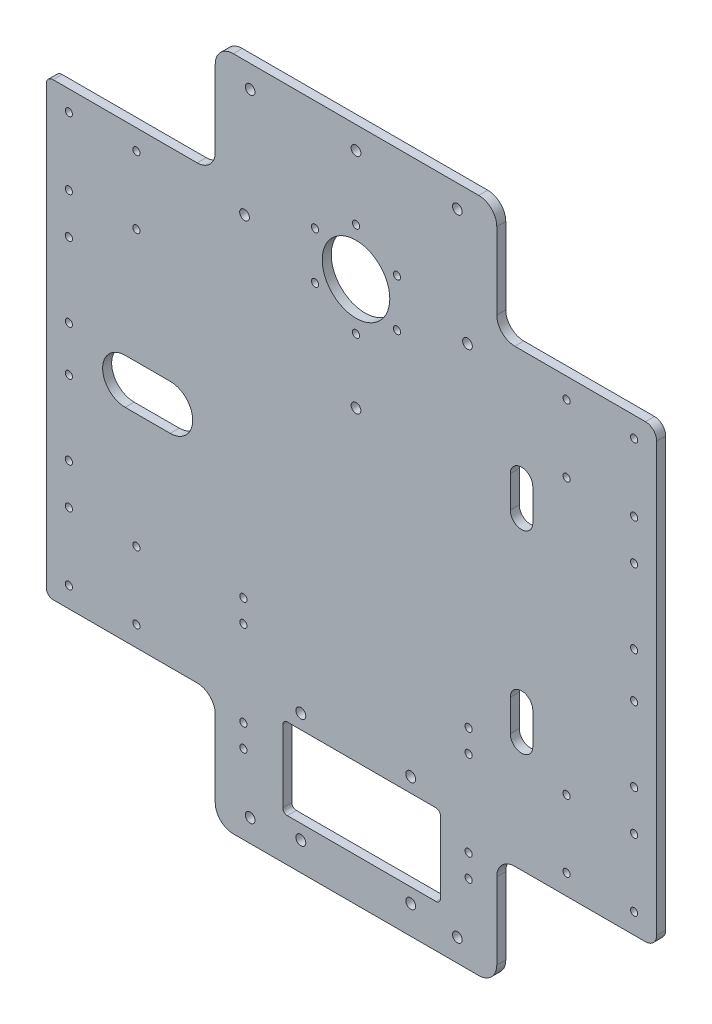
from build123d import *

# Parameters (mm, degrees)
SKETCH_281X300_25_R   = 1.6
SKETCH_281X300_25_R_2 = 15
SKETCH_281X300_25_R_3 = 2.15
SKETCH_281X300_25_R_4 = 2.2
F_4MM_DEPTH           = 4


with BuildPart() as part:
    # 底板轮廓_281x300_安装孔外移25 → 凸台拉伸_4mm (new body)
    with BuildSketch(Plane.XY):
        with BuildLine():
            Line((-55.5, 108), (-55.5, 142))
            ThreePointArc((-55.5, 142), (-53.156854249, 147.656854249), (-47.5, 150))
            Line((-47.5, 150), (61.5, 150))
            ThreePointArc((61.5, 150), (67.156854249, 147.656854249), (69.5, 142))
            Line((69.5, 142), (69.5, 108))
            ThreePointArc((69.5, 108), (71.843145751, 102.343145751), (77.5, 100))
            Line((77.5, 100), (135.5, 100))
            ThreePointArc((135.5, 100), (139.035533906, 98.535533906), (140.5, 95))
            Line((140.5, 95), (140.5, -95))
            ThreePointArc((140.5, -95), (139.035533906, -98.535533906), (135.5, -100))
            Line((135.5, -100), (77.5, -100))
            ThreePointArc((77.5, -100), (71.843145751, -102.343145751), (69.5, -108))
            Line((69.5, -108), (69.5, -142))
            ThreePointArc((69.5, -142), (67.156854249, -147.656854249), (61.5, -150))
            Line((61.5, -150), (-47.5, -150))
            ThreePointArc((-47.5, -150), (-53.156854249, -147.656854249), (-55.5, -142))
            Line((-55.5, -142), (-55.5, -108))
            ThreePointArc((-55.5, -108), (-57.843145751, -102.343145751), (-63.5, -100))
            Line((-63.5, -100), (-127.5, -100))
            ThreePointArc((-127.5, -100), (-129.621320344, -99.121320344), (-130.5, -97))
            Line((-130.5, -97), (-130.5, -13))
            Line((-130.5, -13), (-130.5, 97))
            ThreePointArc((-130.5, 97), (-129.621320344, 99.121320344), (-127.5, 100))
            Line((-127.5, 100), (-63.5, 100))
            ThreePointArc((-63.5, 100), (-57.843145751, 102.343145751), (-55.5, 108))
        make_face()
        with Locations((100.5, -61)):
            Circle(SKETCH_281X300_25_R, mode=Mode.SUBTRACT)
        with Locations((130.5, -61)):
            Circle(SKETCH_281X300_25_R, mode=Mode.SUBTRACT)
        with Locations((100.5, 61)):
            Circle(SKETCH_281X300_25_R, mode=Mode.SUBTRACT)
        with Locations((7, 90.5)):
            Circle(SKETCH_281X300_25_R_2, mode=Mode.SUBTRACT)
        with Locations((7, 140)):
            Circle(SKETCH_281X300_25_R_3, mode=Mode.SUBTRACT)
        with Locations((-42.5, 90.5)):
            Circle(SKETCH_281X300_25_R_3, mode=Mode.SUBTRACT)
        with Locations((56.5, 90.5)):
            Circle(SKETCH_281X300_25_R_3, mode=Mode.SUBTRACT)
        with Locations((-40, 140)):
            Circle(SKETCH_281X300_25_R_3, mode=Mode.SUBTRACT)
        with Locations((130.5, 61)):
            Circle(SKETCH_281X300_25_R, mode=Mode.SUBTRACT)
        with Locations((7, 41)):
            Circle(SKETCH_281X300_25_R_3, mode=Mode.SUBTRACT)
        with Locations((31.290367902, -137.395183951)):
            Circle(SKETCH_281X300_25_R_4, mode=Mode.SUBTRACT)
        with Locations((-17.5, -137.395183951)):
            Circle(SKETCH_281X300_25_R_4, mode=Mode.SUBTRACT)
        with Locations((-17.5, -88.604816049)):
            Circle(SKETCH_281X300_25_R_4, mode=Mode.SUBTRACT)
        with Locations((31.290367902, -88.604816049)):
            Circle(SKETCH_281X300_25_R_4, mode=Mode.SUBTRACT)
        with Locations((7, 111.5)):
            Circle(SKETCH_281X300_25_R, mode=Mode.SUBTRACT)
        with Locations((25.186533479, 101)):
            Circle(SKETCH_281X300_25_R, mode=Mode.SUBTRACT)
        with Locations((100.5, -91)):
            Circle(SKETCH_281X300_25_R, mode=Mode.SUBTRACT)
        with Locations((25.186533479, 80)):
            Circle(SKETCH_281X300_25_R, mode=Mode.SUBTRACT)
        with Locations((100.5, 91)):
            Circle(SKETCH_281X300_25_R, mode=Mode.SUBTRACT)
        with Locations((7, 69.5)):
            Circle(SKETCH_281X300_25_R, mode=Mode.SUBTRACT)
        with Locations((130.5, 91)):
            Circle(SKETCH_281X300_25_R, mode=Mode.SUBTRACT)
        with Locations((130.5, -91)):
            Circle(SKETCH_281X300_25_R, mode=Mode.SUBTRACT)
        with Locations((-43, -105)):
            Circle(SKETCH_281X300_25_R, mode=Mode.SUBTRACT)
        with Locations((57, -57)):
            Circle(SKETCH_281X300_25_R, mode=Mode.SUBTRACT)
        with Locations((-43, -57)):
            Circle(SKETCH_281X300_25_R, mode=Mode.SUBTRACT)
        with Locations((57, -105)):
            Circle(SKETCH_281X300_25_R, mode=Mode.SUBTRACT)
        with Locations((-11.186533479, 80)):
            Circle(SKETCH_281X300_25_R, mode=Mode.SUBTRACT)
        with Locations((-11.186533479, 101)):
            Circle(SKETCH_281X300_25_R, mode=Mode.SUBTRACT)
        with Locations((130.5, 10)):
            Circle(SKETCH_281X300_25_R, mode=Mode.SUBTRACT)
        with Locations((130.5, -10)):
            Circle(SKETCH_281X300_25_R, mode=Mode.SUBTRACT)
        with Locations((-120.5, 10)):
            Circle(SKETCH_281X300_25_R, mode=Mode.SUBTRACT)
        with Locations((-120.5, -10)):
            Circle(SKETCH_281X300_25_R, mode=Mode.SUBTRACT)
        with Locations((-43, -115)):
            Circle(SKETCH_281X300_25_R, mode=Mode.SUBTRACT)
        with Locations((57, -67)):
            Circle(SKETCH_281X300_25_R, mode=Mode.SUBTRACT)
        with Locations((57, -115)):
            Circle(SKETCH_281X300_25_R, mode=Mode.SUBTRACT)
        with Locations((-43, -67)):
            Circle(SKETCH_281X300_25_R, mode=Mode.SUBTRACT)
        with Locations((-120.5, -91)):
            Circle(SKETCH_281X300_25_R, mode=Mode.SUBTRACT)
        with Locations((-90.5, -91)):
            Circle(SKETCH_281X300_25_R, mode=Mode.SUBTRACT)
        with Locations((-120.5, 91)):
            Circle(SKETCH_281X300_25_R, mode=Mode.SUBTRACT)
        with Locations((-90.5, 91)):
            Circle(SKETCH_281X300_25_R, mode=Mode.SUBTRACT)
        with Locations((-90.5, 61)):
            Circle(SKETCH_281X300_25_R, mode=Mode.SUBTRACT)
        with Locations((-120.5, 61)):
            Circle(SKETCH_281X300_25_R, mode=Mode.SUBTRACT)
        with Locations((-90.5, -61)):
            Circle(SKETCH_281X300_25_R, mode=Mode.SUBTRACT)
        with Locations((-120.5, -61)):
            Circle(SKETCH_281X300_25_R, mode=Mode.SUBTRACT)
        with Locations((130.5, 43)):
            Circle(SKETCH_281X300_25_R, mode=Mode.SUBTRACT)
        with Locations((130.5, -43)):
            Circle(SKETCH_281X300_25_R, mode=Mode.SUBTRACT)
        with Locations((-120.5, 43)):
            Circle(SKETCH_281X300_25_R, mode=Mode.SUBTRACT)
        with Locations((-120.5, -43)):
            Circle(SKETCH_281X300_25_R, mode=Mode.SUBTRACT)
        with Locations((52, 140)):
            Circle(SKETCH_281X300_25_R_3, mode=Mode.SUBTRACT)
        with Locations((-40, -140)):
            Circle(SKETCH_281X300_25_R_3, mode=Mode.SUBTRACT)
        with Locations((52, -140)):
            Circle(SKETCH_281X300_25_R_3, mode=Mode.SUBTRACT)
        with BuildLine():
            Line((-25.5, -97), (-25.5, -129))
            ThreePointArc((-25.5, -129), (-24.914213562, -130.414213562), (-23.5, -131))
            Line((-23.5, -131), (42.5, -131))
            ThreePointArc((42.5, -131), (43.914213562, -130.414213562), (44.5, -129))
            Line((44.5, -129), (44.5, -97))
            ThreePointArc((44.5, -97), (43.914213562, -95.585786438), (42.5, -95))
            Line((42.5, -95), (-23.5, -95))
            ThreePointArc((-23.5, -95), (-24.914213562, -95.585786438), (-25.5, -97))
        make_face(mode=Mode.SUBTRACT)
        with BuildLine():
            Line((75.5, 50), (75.5, 36))
            ThreePointArc((75.5, 36), (80.5, 31), (85.5, 36))
            Line((85.5, 36), (85.5, 50))
            ThreePointArc((85.5, 50), (80.5, 55), (75.5, 50))
        make_face(mode=Mode.SUBTRACT)
        with BuildLine():
            Line((85.5, -50), (85.5, -36))
            ThreePointArc((85.5, -36), (80.5, -31), (75.5, -36))
            Line((75.5, -36), (75.5, -50))
            ThreePointArc((75.5, -50), (80.5, -55), (85.5, -50))
        make_face(mode=Mode.SUBTRACT)
        with BuildLine():
            Line((-95.5, -10), (-75.5, -10))
            ThreePointArc((-75.5, -10), (-65.5, 0), (-75.5, 10))
            Line((-75.5, 10), (-95.5, 10))
            ThreePointArc((-95.5, 10), (-105.5, 0), (-95.5, -10))
        make_face(mode=Mode.SUBTRACT)
    extrude(amount=F_4MM_DEPTH)


solid = part.part
